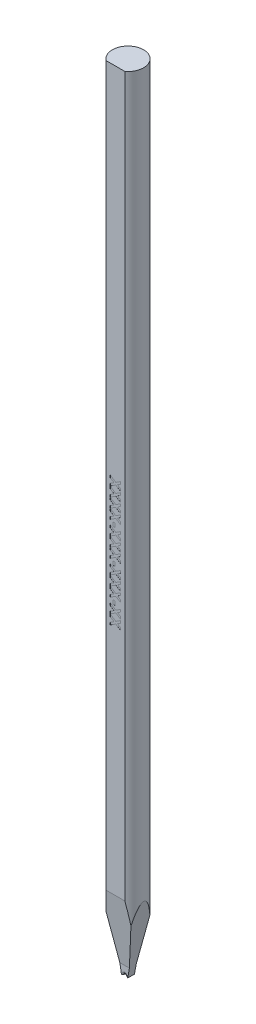
from build123d import *

# Parameters (mm, degrees)
SKETCH_TL_CUTTING_R       = 1.4986
TL_CUTTING_DEPTH          = 75.9968
SKETCH_TDF_GRINDING_W     = 3.0172
SKETCH_TDF_GRINDING_H     = 3.0172
TDF_GRINDING_DEPTH        = 77.026345527
SKETCH_ENGRAVING_W        = 0.166666667
SKETCH_ENGRAVING_H        = 0.371794872
ENGRAVING_DEPTH           = 0.005
VW_VR_GRINDING_DEPTH      = 1.5086
VW_VR_GRINDING_DEPTH_BACK = 1.5086
ISA_GRINDING_DEPTH        = 1.5086
ISA_GRINDING_DEPTH_BACK   = 1.5086
PRE_FRX_BRX_DEPTH         = 1.5086
PRE_FRX_BRX_DEPTH_BACK    = 1.5086
SKETCH_PRE_FRX_BRX_W      = 1.18348
SKETCH_PRE_FRX_BRX_H      = 0.89916
FR_EDM_R                  = 0.14986
BR_EDM_R                  = 0.14986
FA_BA_GRINDING_DEPTH      = 1.5086
FA_BA_GRINDING_DEPTH_BACK = 1.5086


with BuildPart() as part:
    # sketch_TL_cutting → TL_cutting (new body)
    with BuildSketch(Plane(origin=(0, 0, 0), x_dir=(1, 0, 0), z_dir=(0, 1, 0))):
        Circle(SKETCH_TL_CUTTING_R)
    extrude(amount=TL_CUTTING_DEPTH)

    # sketch_TDF_grinding → TDF_grinding (cut, through all)
    with BuildSketch(Plane(origin=(0, 0, 0), x_dir=(1, 0, 0), z_dir=(0, 1, 0))):
        with Locations((0, -2.71002)):
            Rectangle(SKETCH_TDF_GRINDING_W, SKETCH_TDF_GRINDING_H)
    extrude(amount=TDF_GRINDING_DEPTH, mode=Mode.SUBTRACT)

    # sketch_engraving → engraving (cut)
    with BuildSketch(Plane.XY.offset(1.20142)):
        Polygon((-0.5, 41.791829744), (0.029647436, 41.449081346), (0.5, 41.753368205), (0.5, 41.52860859), (0.203325321, 41.336701538), (0.5, 41.144794487), (0.5, 40.920034872), (0.029647436, 41.224321731), (-0.5, 40.881573333), (-0.5, 41.106332949), (-0.144030449, 41.336701538), (-0.5, 41.567070128), align=None)
        Polygon((-0.5, 40.868752821), (0.029647436, 40.526004423), (0.5, 40.830291282), (0.5, 40.605531667), (0.203325321, 40.413624615), (0.5, 40.221717564), (0.5, 39.996957949), (0.029647436, 40.301244808), (-0.5, 39.95849641), (-0.5, 40.183256026), (-0.144030449, 40.413624615), (-0.5, 40.643993205), align=None)
        Polygon((-0.5, 39.945675897), (0.029647436, 39.6029275), (0.5, 39.907214359), (0.5, 39.682454744), (0.203325321, 39.490547692), (0.5, 39.298640641), (0.5, 39.073881026), (0.029647436, 39.378167885), (-0.5, 39.035419487), (-0.5, 39.260179103), (-0.144030449, 39.490547692), (-0.5, 39.720916282), align=None)
        Polygon((-0.5, 39.022598974), (0.029647436, 38.679850577), (0.5, 38.984137436), (0.5, 38.759377821), (0.203325321, 38.567470769), (0.5, 38.375563718), (0.5, 38.150804103), (0.029647436, 38.455090962), (-0.5, 38.112342564), (-0.5, 38.337102179), (-0.144030449, 38.567470769), (-0.5, 38.797839359), align=None)
        with Locations((-0.147435898, 37.843111795)):
            Rectangle(SKETCH_ENGRAVING_W, SKETCH_ENGRAVING_H)
        Polygon((-0.5, 37.63798359), (0.029647436, 37.295235192), (0.5, 37.599522051), (0.5, 37.374762436), (0.203325321, 37.182855385), (0.5, 36.990948333), (0.5, 36.766188718), (0.029647436, 37.070475577), (-0.5, 36.727727179), (-0.5, 36.952486795), (-0.144030449, 37.182855385), (-0.5, 37.413223974), align=None)
        Polygon((-0.5, 36.714906667), (0.029647436, 36.372158269), (0.5, 36.676445128), (0.5, 36.451685513), (0.203325321, 36.259778462), (0.5, 36.06787141), (0.5, 35.843111795), (0.029647436, 36.147398654), (-0.5, 35.804650256), (-0.5, 36.029409872), (-0.144030449, 36.259778462), (-0.5, 36.490147051), align=None)
        Polygon((-0.5, 35.791829744), (0.029647436, 35.449081346), (0.5, 35.753368205), (0.5, 35.52860859), (0.203325321, 35.336701538), (0.5, 35.144794487), (0.5, 34.920034872), (0.029647436, 35.224321731), (-0.5, 34.881573333), (-0.5, 35.106332949), (-0.144030449, 35.336701538), (-0.5, 35.567070128), align=None)
        with Locations((-0.147435898, 34.612342564)):
            Rectangle(SKETCH_ENGRAVING_W, SKETCH_ENGRAVING_H)
        Polygon((-0.5, 34.407214359), (0.029647436, 34.064465962), (0.5, 34.368752821), (0.5, 34.143993205), (0.203325321, 33.952086154), (0.5, 33.760179103), (0.5, 33.535419487), (0.029647436, 33.839706346), (-0.5, 33.496957949), (-0.5, 33.721717564), (-0.144030449, 33.952086154), (-0.5, 34.182454744), align=None)
        Polygon((-0.5, 33.484137436), (0.029647436, 33.141389038), (0.5, 33.445675897), (0.5, 33.220916282), (0.203325321, 33.029009231), (0.5, 32.837102179), (0.5, 32.612342564), (0.029647436, 32.916629423), (-0.5, 32.573881026), (-0.5, 32.798640641), (-0.144030449, 33.029009231), (-0.5, 33.259377821), align=None)
        Polygon((-0.5, 32.561060513), (0.029647436, 32.218312115), (0.5, 32.522598974), (0.5, 32.297839359), (0.203325321, 32.105932308), (0.5, 31.914025256), (0.5, 31.689265641), (0.029647436, 31.9935525), (-0.5, 31.650804103), (-0.5, 31.875563718), (-0.144030449, 32.105932308), (-0.5, 32.336300897), align=None)
        with Locations((-0.147435898, 31.381573333)):
            Rectangle(SKETCH_ENGRAVING_W, SKETCH_ENGRAVING_H)
        Polygon((-0.5, 31.176445128), (0.029647436, 30.833696731), (0.5, 31.13798359), (0.5, 30.913223974), (0.203325321, 30.721316923), (0.5, 30.529409872), (0.5, 30.304650256), (0.029647436, 30.608937115), (-0.5, 30.266188718), (-0.5, 30.490948333), (-0.144030449, 30.721316923), (-0.5, 30.951685513), align=None)
        Polygon((-0.5, 30.253368205), (0.029647436, 29.910619808), (0.5, 30.214906667), (0.5, 29.990147051), (0.203325321, 29.79824), (0.5, 29.606332949), (0.5, 29.381573333), (0.029647436, 29.685860192), (-0.5, 29.343111795), (-0.5, 29.56787141), (-0.144030449, 29.79824), (-0.5, 30.02860859), align=None)
    extrude(amount=-ENGRAVING_DEPTH, mode=Mode.SUBTRACT)

    # sketch_VW_VR_grinding → VW_VR_grinding (cut, two sides: drawn at the far end of the back side and taken through both)
    with BuildSketch(Plane.XY.offset(-VW_VR_GRINDING_DEPTH_BACK)):
        with BuildLine():
            Line((-1.4936, -0.01), (-1.4936, 0.88416))
            ThreePointArc((-1.4936, 0.88416), (-1.495064466, 0.887695534), (-1.4986, 0.88916))
            Line((-1.4986, 0.88916), (-1.5086, 0.88916))
            Line((-1.5086, 0.88916), (-1.5086, -0.01))
            Line((-1.5086, -0.01), (-1.4936, -0.01))
        make_face()
        with BuildLine():
            Line((1.4936, -0.01), (1.4936, 0.88416))
            ThreePointArc((1.4936, 0.88416), (1.495064466, 0.887695534), (1.4986, 0.88916))
            Line((1.4986, 0.88916), (1.5086, 0.88916))
            Line((1.5086, 0.88916), (1.5086, -0.01))
            Line((1.5086, -0.01), (1.4936, -0.01))
        make_face()
    extrude(amount=VW_VR_GRINDING_DEPTH + VW_VR_GRINDING_DEPTH_BACK, mode=Mode.SUBTRACT)

    # sketch_ISA_grinding → ISA_grinding (cut, two sides: drawn at the far end of the back side and taken through both)
    with BuildSketch(Plane.XY.offset(-ISA_GRINDING_DEPTH_BACK)):
        Polygon((-0.29972, 0), (-1.5086, 6.855899166), (-1.5086, -0.01), (1.5086, -0.01), (1.5086, 6.855899166), (0.29972, 0), align=None)
    extrude(amount=ISA_GRINDING_DEPTH + ISA_GRINDING_DEPTH_BACK, mode=Mode.SUBTRACT)

    # sketch_pre_FRX_BRX → pre_FRX_BRX (cut, two sides: drawn at the far end of the back side and taken through both)
    with BuildSketch(Plane(origin=(0, 0, 0), x_dir=(0, 0, -1), z_dir=(1, 0, 0)).offset(-PRE_FRX_BRX_DEPTH_BACK)):
        with Locations((-0.91686, 0.43958)):
            Rectangle(SKETCH_PRE_FRX_BRX_W, SKETCH_PRE_FRX_BRX_H)
        with Locations((0.91686, 0.43958)):
            Rectangle(SKETCH_PRE_FRX_BRX_W, SKETCH_PRE_FRX_BRX_H)
    extrude(amount=PRE_FRX_BRX_DEPTH + PRE_FRX_BRX_DEPTH_BACK, mode=Mode.SUBTRACT)

    # V-Groove_EDM: sweep along a path in sketch_contour_V-Groove
    with BuildLine(Plane(origin=(0, 0, 0), x_dir=(0, 0, -1), z_dir=(1, 0, 0))) as v_groove_edm_path:
        Line((-1.20142, 0.1905), (0, 0.1905))
        Line((0, 0.1905), (1.4986, 0.1905))
    # sketch_section_V-Groove → V-Groove_EDM (sweep, cut)
    with BuildSketch(Plane.XY.offset(1.20142)):
        with BuildLine():
            Line((-1.49899536, -1.905), (-0.049898839, 0.164524309))
            ThreePointArc((-0.049898839, 0.164524309), (0, 0.1905), (0.049898839, 0.164524309))
            Line((0.049898839, 0.164524309), (1.49899536, -1.905))
            Line((1.49899536, -1.905), (-1.49899536, -1.905))
        make_face()
    sweep(path=v_groove_edm_path.line, mode=Mode.SUBTRACT)

    # FR_EDM
    fr_edm_edges = [part.edges().sort_by_distance(p)[0] for p in [
        (0.107499419, 0.082262154, 0.32512),
        (0, 0.1905, 0.32512),
        (-0.107499419, 0.082262154, 0.32512),
    ]]
    fillet(fr_edm_edges, radius=FR_EDM_R)

    # BR_EDM
    br_edm_edges = [part.edges().sort_by_distance(p)[0] for p in [
        (0.107499419, 0.082262154, -0.32512),
        (0, 0.1905, -0.32512),
        (-0.107499419, 0.082262154, -0.32512),
    ]]
    fillet(br_edm_edges, radius=BR_EDM_R)

    # sketch_FA_BA_grinding → FA_BA_grinding (cut, two sides: drawn at the far end of the back side and taken through both)
    with BuildSketch(Plane(origin=(0, 0, 0), x_dir=(0, 0, -1), z_dir=(1, 0, 0)).offset(-FA_BA_GRINDING_DEPTH_BACK)):
        Polygon((2.4986, 16.364273784), (2.4986, -0.1), (0.32512, -0.1), (0.32512, 0.89916), align=None)
        Polygon((-3.272828656, 21.873196919), (-0.32512, 0.89916), (-0.32512, -0.1), (-3.272828656, -0.1), align=None)
    extrude(amount=FA_BA_GRINDING_DEPTH + FA_BA_GRINDING_DEPTH_BACK, mode=Mode.SUBTRACT)


solid = part.part
